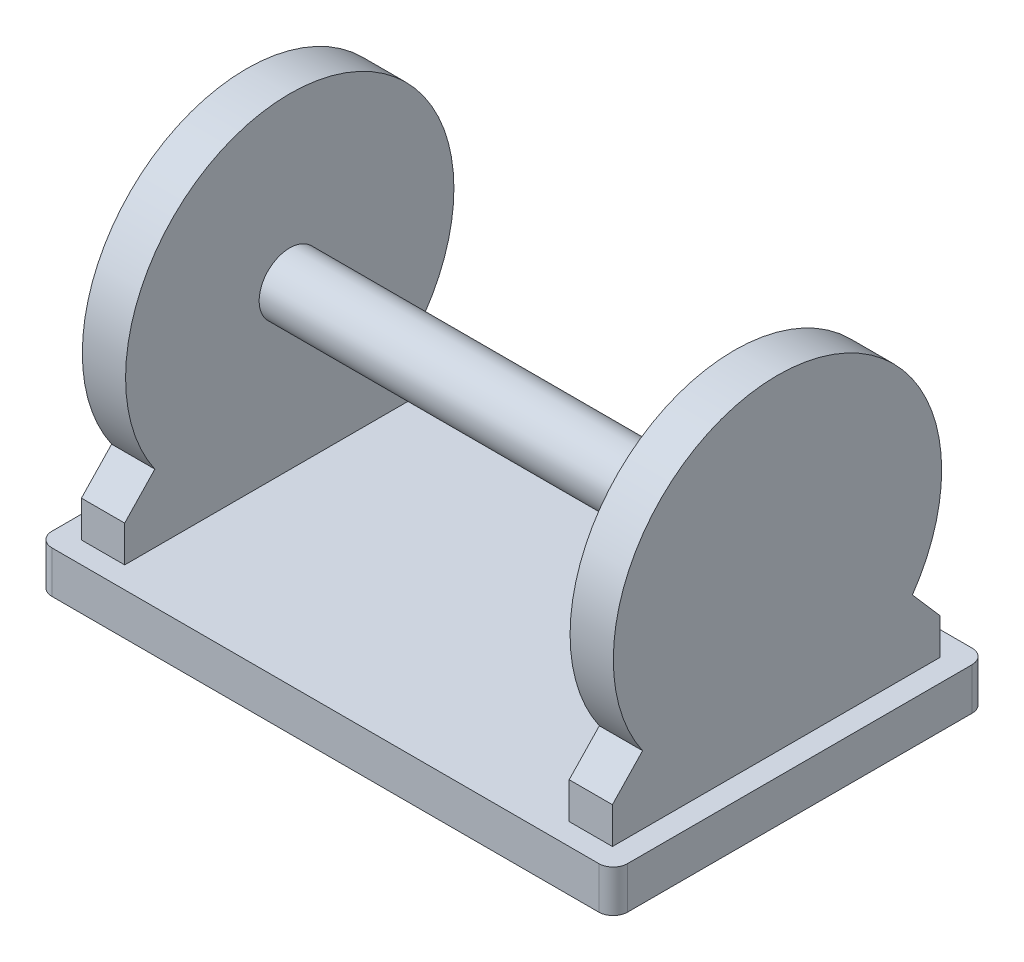
from build123d import *

# Parameters (mm, degrees)
SKETCH2_W           = 79.88
SKETCH2_H           = 51.8
BOSS_EXTRUDE1_DEPTH = 5.84
FILLET2_R           = 2
FILLET3_R           = 2
FILLET4_R           = 2
BOSS_EXTRUDE3_START = -3.1
BOSS_EXTRUDE3_DEPTH = 6
FILLET6_R           = 2
BOSS_EXTRUDE5_REACH = 93.015
SKETCH10_R          = 4.249482904


with BuildPart() as part:
    # Sketch2 → Boss-Extrude1 (new body)
    with BuildSketch(Plane(origin=(0, 0, 0), x_dir=(1, 0, 0), z_dir=(0, 1, 0))):
        Rectangle(SKETCH2_W, SKETCH2_H)
    extrude(amount=BOSS_EXTRUDE1_DEPTH)

    # Fillet2
    fillet2_edges = [part.edges().sort_by_distance(p)[0] for p in [
        (-39.94, 2.92, -25.9),
    ]]
    fillet(fillet2_edges, radius=FILLET2_R)

    # Fillet3
    fillet3_edges = [part.edges().sort_by_distance(p)[0] for p in [
        (-39.94, 2.92, 25.9),
    ]]
    fillet(fillet3_edges, radius=FILLET3_R)

    # Fillet4
    fillet4_edges = [part.edges().sort_by_distance(p)[0] for p in [
        (39.94, 2.92, -25.9),
    ]]
    fillet(fillet4_edges, radius=FILLET4_R)

    # Sketch3 → Boss-Extrude3 (add)
    with BuildSketch(Plane.ZY.offset(39.94).offset(BOSS_EXTRUDE3_START)):
        with BuildLine():
            Line((-22.543575681, 5.84), (22.906424319, 5.84))
            Line((22.906424319, 5.84), (22.906424319, 10.87))
            Line((22.906424319, 10.87), (18.720256409, 15.26))
            ThreePointArc((18.720256409, 15.26), (0, 51.02), (-18.720256409, 15.26))
            Line((-18.720256409, 15.26), (-22.543575681, 10.87))
            Line((-22.543575681, 10.87), (-22.543575681, 5.84))
        make_face()
    boss_extrude3 = extrude(amount=-BOSS_EXTRUDE3_DEPTH)

    # Fillet6
    fillet6_edges = [part.edges().sort_by_distance(p)[0] for p in [
        (39.94, 2.92, 25.9),
    ]]
    fillet(fillet6_edges, radius=FILLET6_R)

    # Mirror1: Boss-Extrude3 across plane
    add(boss_extrude3.mirror(Plane(origin=(0, 0, 0), x_dir=(0, 0, 1), z_dir=(1, 0, 0))))

    # Sketch10 → Boss-Extrude5 (add, up to next)
    with BuildSketch(Plane(origin=(-30.84, 0, 0), x_dir=(0, 0, -1), z_dir=(1, 0, 0)), mode=Mode.PRIVATE) as boss_extrude5_sk1:
        with Locations(Location((0, 28.24, 0), (0, 0, 180))):
            Circle(SKETCH10_R)
    boss_extrude5_tool1 = extrude(boss_extrude5_sk1.sketch, amount=BOSS_EXTRUDE5_REACH, mode=Mode.PRIVATE) - part.part
    add(boss_extrude5_tool1.solids().sort_by_distance((-30.84, 28.24, 0))[0])


solid = part.part
